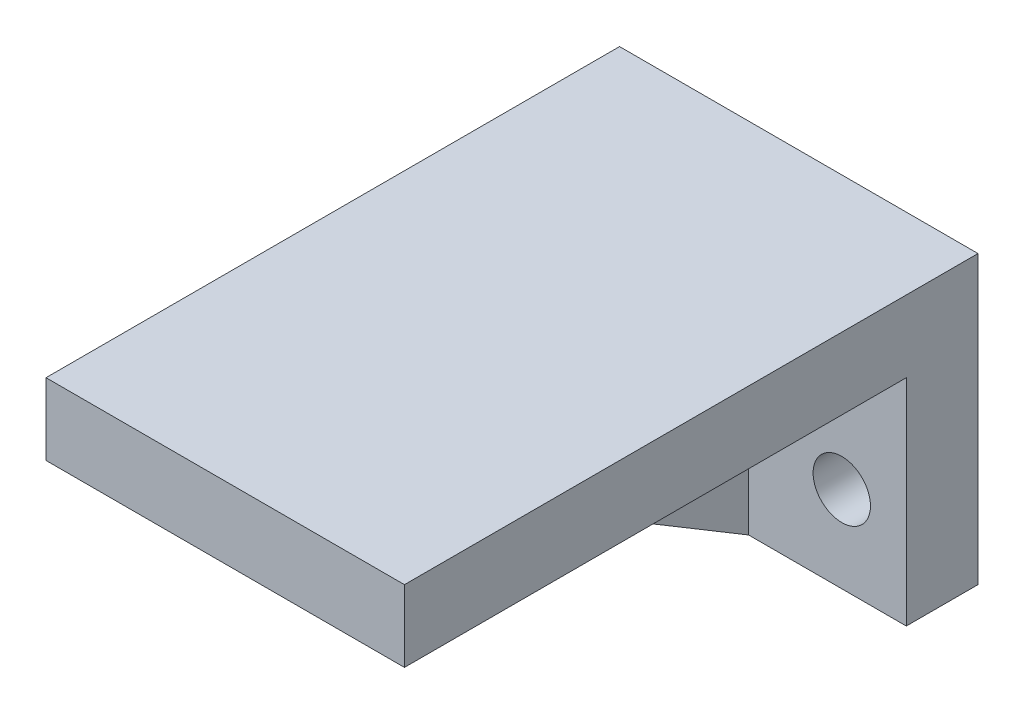
from build123d import *

# Parameters (mm, degrees)
BOSS_EXTRUDE1_DEPTH = 12.5
BOSS_EXTRUDE2_DEPTH = 1.5
SKETCH3_R           = 2
CUT_EXTRUDE1_DEPTH  = 43.20485754


with BuildPart() as part:
    # Sketch1 → Boss-Extrude1 (new, symmetric)
    with BuildSketch(Plane(origin=(0, 0, 0), x_dir=(0, 0, -1), z_dir=(1, 0, 0))):
        Polygon((0, 0), (-40, 0), (-40, -5), (-5, -5), (-5, -20), (0, -20), align=None)
    extrude(amount=BOSS_EXTRUDE1_DEPTH, both=True)

    # Sketch2 → Boss-Extrude2 (add, symmetric)
    with BuildSketch(Plane(origin=(0, 0, 0), x_dir=(0, 0, -1), z_dir=(1, 0, 0))):
        Polygon((-30, -5), (-5, -20), (-5, -5), align=None)
    extrude(amount=BOSS_EXTRUDE2_DEPTH, both=True)

    # Sketch3 → Cut-Extrude1 (cut, through all)
    with BuildSketch(Plane.XY.offset(5)):
        with Locations((8, -14)):
            Circle(SKETCH3_R)
        with Locations((-8, -14)):
            Circle(SKETCH3_R)
    extrude(amount=-CUT_EXTRUDE1_DEPTH, mode=Mode.SUBTRACT)


solid = part.part
